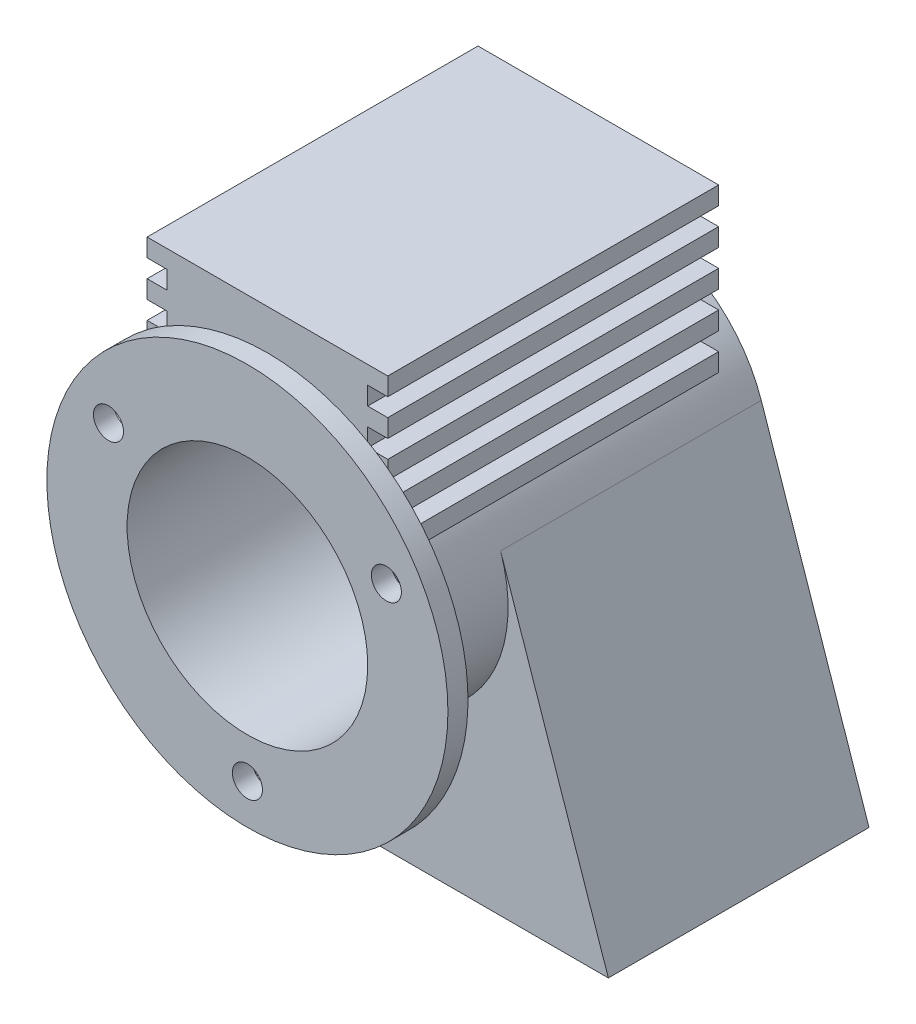
from build123d import *

# Parameters (mm, degrees)
BOSS_EXTRUDE1_DEPTH = 4.125
SKETCH2_R           = 5
BOSS_EXTRUDE2_DEPTH = 0.5
SKETCH3_R           = 3.5
CUT_EXTRUDE1_DEPTH  = 9
SKETCH4_R           = 0.375
CUT_EXTRUDE2_DEPTH  = 0.5
CIRPATTERN1_COUNT   = 3
BOSS_EXTRUDE3_START = 6.5
BOSS_EXTRUDE3_DEPTH = 6.5
SKETCH7_R           = 3.5
BOSS_EXTRUDE4_DEPTH = 6.5
SKETCH8_R           = 3
CUT_EXTRUDE3_DEPTH  = 9
SKETCH6_R           = 0.75
CUT_EXTRUDE4_DEPTH  = 9


with BuildPart() as part:
    # Sketch1 → Boss-Extrude1 (new, symmetric)
    with BuildSketch(Plane.XY):
        Polygon((3, 0), (-3, 0), (-3, -0.45), (-2.5, -0.45), (-2.5, -0.9), (-3, -0.9), (-3, -1.35), (-2.5, -1.35), (-2.5, -1.8), (-3, -1.8), (-3, -2.25), (-2.5, -2.25), (-2.5, -2.7), (-3, -2.7), (-3, -3.15), (-2.5, -3.15), (-2.5, -3.6), (-3, -3.6), (-3, -4.05), (-2.5, -4.05), (-2.5, -4.5), (-3, -4.5), (-3, -4.95), (-2.5, -4.95), (-2.5, -5.4), (-3, -5.4), (-3, -5.85), (-2.5, -5.85), (-2.5, -6.3), (2.5, -6.3), (2.5, -5.85), (3, -5.85), (3, -5.4), (2.5, -5.4), (2.5, -4.95), (3, -4.95), (3, -4.5), (2.5, -4.5), (2.5, -4.05), (3, -4.05), (3, -3.6), (2.5, -3.6), (2.5, -3.15), (3, -3.15), (3, -2.7), (2.5, -2.7), (2.5, -2.25), (3, -2.25), (3, -1.8), (2.5, -1.8), (2.5, -1.35), (3, -1.35), (3, -0.9), (2.5, -0.9), (2.5, -0.45), (3, -0.45), align=None)
    extrude(amount=BOSS_EXTRUDE1_DEPTH, both=True)

    # Sketch2 → Boss-Extrude2 (add)
    with BuildSketch(Plane.XY.offset(4.125)):
        with Locations(Location((0, -6, 0), (0, 0, 126.869897646))):
            Circle(SKETCH2_R)
    extrude(amount=BOSS_EXTRUDE2_DEPTH)

    # Sketch3 → Cut-Extrude1 (cut)
    with BuildSketch(Plane.XY.offset(4.625)):
        with Locations((0, -6)):
            Circle(SKETCH3_R)
    extrude(amount=-CUT_EXTRUDE1_DEPTH, mode=Mode.SUBTRACT)

    # Sketch4 → Cut-Extrude2 (cut)
    with BuildSketch(Plane.XY.offset(4.625)):
        with Locations((3.464101615, -4)):
            Circle(SKETCH4_R)
    cut_extrude2 = extrude(amount=-CUT_EXTRUDE2_DEPTH, mode=Mode.SUBTRACT)

    # CirPattern1: Cut-Extrude2 ×3 about axis
    cirpattern1_axis = Axis((0, -6, 0), (0, 0, 1))
    for i in range(1, CIRPATTERN1_COUNT):
        add(cut_extrude2.rotate(cirpattern1_axis, i * 360 / CIRPATTERN1_COUNT), mode=Mode.SUBTRACT)

    # Sketch5 → Boss-Extrude3 (add)
    with BuildSketch(Plane.XY.offset(-4.875).offset(BOSS_EXTRUDE3_START)):
        with BuildLine():
            Line((6, -12.75), (-6, -12.75))
            Line((-6, -12.75), (-3.312648335, -4.870238517))
            ThreePointArc((-3.312648335, -4.870238517), (0, -2.5), (3.312648335, -4.870238517))
            Line((3.312648335, -4.870238517), (6, -12.75))
        make_face()
    extrude(amount=-BOSS_EXTRUDE3_DEPTH)

    # Sketch7 → Boss-Extrude4 (add)
    with BuildSketch(Plane.XY.offset(4.625)):
        with Locations(Location((0, -6, 0), (0, 0, 161.168324383))):
            Circle(SKETCH7_R)
    extrude(amount=-BOSS_EXTRUDE4_DEPTH)

    # Sketch8 → Cut-Extrude3 (cut)
    with BuildSketch(Plane.XY.offset(4.625)):
        with Locations((0, -6)):
            Circle(SKETCH8_R)
    extrude(amount=-CUT_EXTRUDE3_DEPTH, mode=Mode.SUBTRACT)

    # Sketch6 → Cut-Extrude4 (cut)
    with BuildSketch(Plane(origin=(0, 0, -4.875), x_dir=(-1, 0, 0), z_dir=(0, 0, -1))):
        with Locations((0, -6)):
            Circle(SKETCH6_R)
    extrude(amount=-CUT_EXTRUDE4_DEPTH, mode=Mode.SUBTRACT)


solid = part.part
